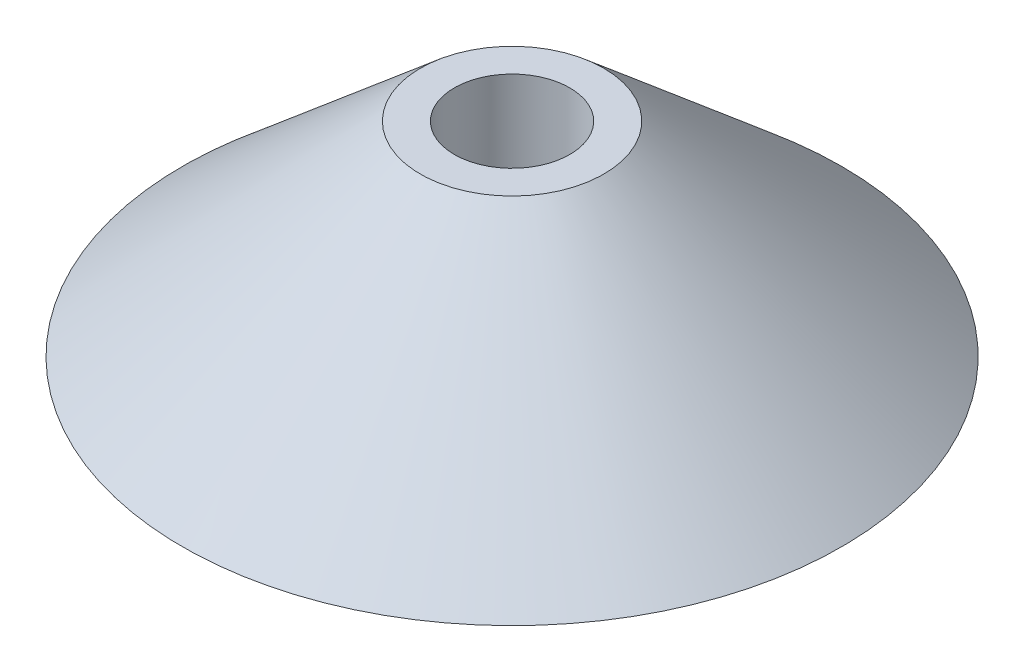
from build123d import *

# Parameters (mm, degrees)
CUT_EXTRUDE1_DEPTH = 2.5


with BuildPart() as part:
    # Sketch1 → Revolve1 (revolve)
    with BuildSketch(Plane.XY, mode=Mode.PRIVATE) as revolve1_sk:
        Polygon((-2.7, 6), (-9.7, 0), (-1.7, 0), (-1.7, 6), align=None)
    revolve(revolve1_sk.sketch.rotate(Axis((0, 11.326530612, 0), (0, -1, 0)), 270), axis=Axis((0, 11.326530612, 0), (0, -1, 0)))

    # Sketch2 → Cut-Extrude1 (cut)
    with BuildSketch(Plane.XZ):
        Polygon((1.697539741, -3.019662039), (3.463873907, -0.03971848), (1.766334166, 2.979943559), (-1.697539741, 3.019662039), (-3.463873907, 0.03971848), (-1.766334166, -2.979943559), align=None)
    extrude(amount=-CUT_EXTRUDE1_DEPTH, mode=Mode.SUBTRACT)


solid = part.part
